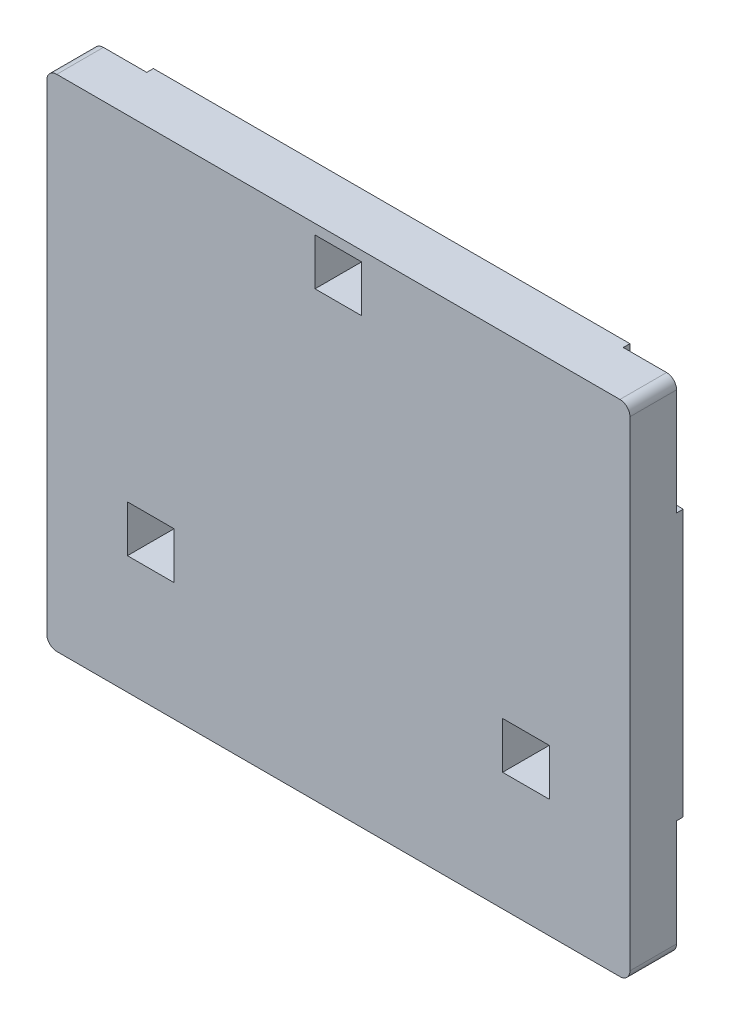
from build123d import *

# Parameters (mm, degrees)
SKETCH1_W           = 175
SKETCH1_H           = 150
BOSS_EXTRUDE1_DEPTH = 16
SKETCH2_W           = 14
SKETCH2_H           = 14
CUT_EXTRUDE1_DEPTH  = 14
SKETCH4_W           = 16
SKETCH4_H           = 35
CUT_EXTRUDE5_DEPTH  = 2
FILLET1_R           = 3


with BuildPart() as part:
    # Sketch1 → Boss-Extrude1 (new body)
    with BuildSketch(Plane.XY):
        with Locations((-87.5, -75)):
            Rectangle(SKETCH1_W, SKETCH1_H)
    extrude(amount=BOSS_EXTRUDE1_DEPTH)

    # Sketch2 → Cut-Extrude1 (cut)
    with BuildSketch(Plane.XY.offset(16)):
        with Locations((-87.5, -10)):
            Rectangle(SKETCH2_W, SKETCH2_H)
        with Locations((-143.791651246, -107.5)):
            Rectangle(SKETCH2_W, SKETCH2_H)
        with Locations((-31.208348754, -107.5)):
            Rectangle(SKETCH2_W, SKETCH2_H)
    extrude(amount=-CUT_EXTRUDE1_DEPTH, mode=Mode.SUBTRACT)

    # Sketch4 → Cut-Extrude5 (cut)
    with BuildSketch(Plane(origin=(0, 0, 0), x_dir=(-1, 0, 0), z_dir=(0, 0, -1))):
        with Locations((167, -17.5)):
            Rectangle(SKETCH4_W, SKETCH4_H)
        with Locations((167, -132.5)):
            Rectangle(SKETCH4_W, SKETCH4_H)
        with Locations((8, -132.5)):
            Rectangle(SKETCH4_W, SKETCH4_H)
        with Locations((8, -17.5)):
            Rectangle(SKETCH4_W, SKETCH4_H)
    extrude(amount=-CUT_EXTRUDE5_DEPTH, mode=Mode.SUBTRACT)

    # Fillet1
    fillet1_edges = [part.edges().sort_by_distance(p)[0] for p in [
        (0, -150, 9),
        (-175, -150, 9),
        (-175, 0, 9),
        (0, 0, 9),
    ]]
    fillet(fillet1_edges, radius=FILLET1_R)


solid = part.part
